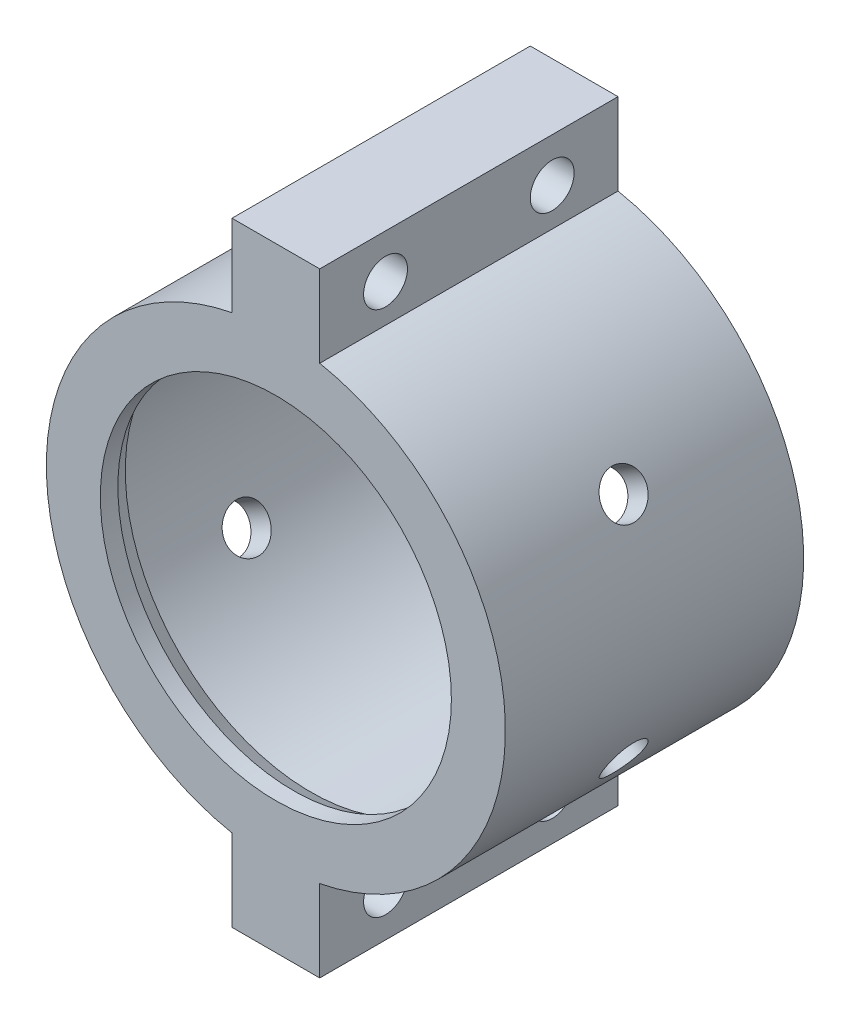
from build123d import *

# Parameters (mm, degrees)
SKETCH8_W               = 3.38
SKETCH8_H               = 38.1
BOSS_EXTRUDE10_DEPTH    = 43.18
CUT_EXTRUDE7_DEPTH      = 71.315115907
CUT_EXTRUDE7_DEPTH_BACK = 71.315115907
SKETCH18_R              = 3.175
SKETCH23_R              = 3.175
CUT_EXTRUDE9_DEPTH      = 71.315115907


with BuildPart() as part:
    # Sketch2 → Revolve1 (revolve)
    with BuildSketch(Plane(origin=(0, 0, 0), x_dir=(1, 0, 0), z_dir=(0, 1, 0))):
        Polygon((25.408530316, 0), (25.408530316, 2.54), (26.875, 5.08), (33.225, 5.08), (33.225, 0), align=None)
    revolve(axis=Axis((0, 0, 0), (0, 0, -1)))

    # Sketch8 → Revolve2 (revolve)
    with BuildSketch(Plane(origin=(0, 0, 0), x_dir=(1, 0, 0), z_dir=(0, 1, 0)), mode=Mode.PRIVATE) as revolve2_sk:
        with Locations((-31.535, 24.13)):
            Rectangle(SKETCH8_W, SKETCH8_H)
    revolve(revolve2_sk.sketch.rotate(Axis((0, 0, 0), (0, 0, -1)), 180), axis=Axis((0, 0, 0), (0, 0, -1)))

    # Sketch19 → Boss-Extrude10 (add)
    with BuildSketch(Plane.XY):
        with BuildLine():
            Line((-6.35, 32.612545515), (-6.35, 44.45))
            Line((-6.35, 44.45), (6.35, 44.45))
            Line((6.35, 44.45), (6.35, 32.612545515))
            ThreePointArc((6.35, 32.612545515), (0, 33.225), (-6.35, 32.612545515))
        make_face()
        with BuildLine():
            Line((6.35, -44.45), (-6.35, -44.45))
            Line((-6.35, -44.45), (-6.35, -32.612545515))
            ThreePointArc((-6.35, -32.612545515), (0, -33.225), (6.35, -32.612545515))
            Line((6.35, -32.612545515), (6.35, -44.45))
        make_face()
    extrude(amount=-BOSS_EXTRUDE10_DEPTH)

    # Sketch18 → Cut-Extrude7 (cut, two sides: drawn at the far end of the back side and taken through both)
    with BuildSketch(Plane(origin=(0, 0, 0), x_dir=(0, 0, -1), z_dir=(1, 0, 0)).offset(-CUT_EXTRUDE7_DEPTH_BACK)):
        with Locations((9.525, 38.1)):
            Circle(SKETCH18_R)
        with Locations((33.655, 38.1)):
            Circle(SKETCH18_R)
        with Locations((9.525, -38.1)):
            Circle(SKETCH18_R)
        with Locations((33.655, -38.1)):
            Circle(SKETCH18_R)
    extrude(amount=CUT_EXTRUDE7_DEPTH + CUT_EXTRUDE7_DEPTH_BACK, mode=Mode.SUBTRACT)

    # Sketch23 → Cut-Extrude9 (cut, symmetric)
    with BuildSketch(Plane(origin=(0, 0, 0), x_dir=(-0.5000000000000014, 0.8660254037844378, 0), z_dir=(-0.8660254037844378, -0.5000000000000014, 0))):
        with Locations(Location((0, 21.59, 0), (0, 0, 180))):
            Circle(SKETCH23_R)
    cut_extrude9 = extrude(amount=CUT_EXTRUDE9_DEPTH, both=True, mode=Mode.SUBTRACT)

    # Mirror3: Cut-Extrude9 across plane
    add(cut_extrude9.mirror(Plane.ZX), mode=Mode.SUBTRACT)


solid = part.part
